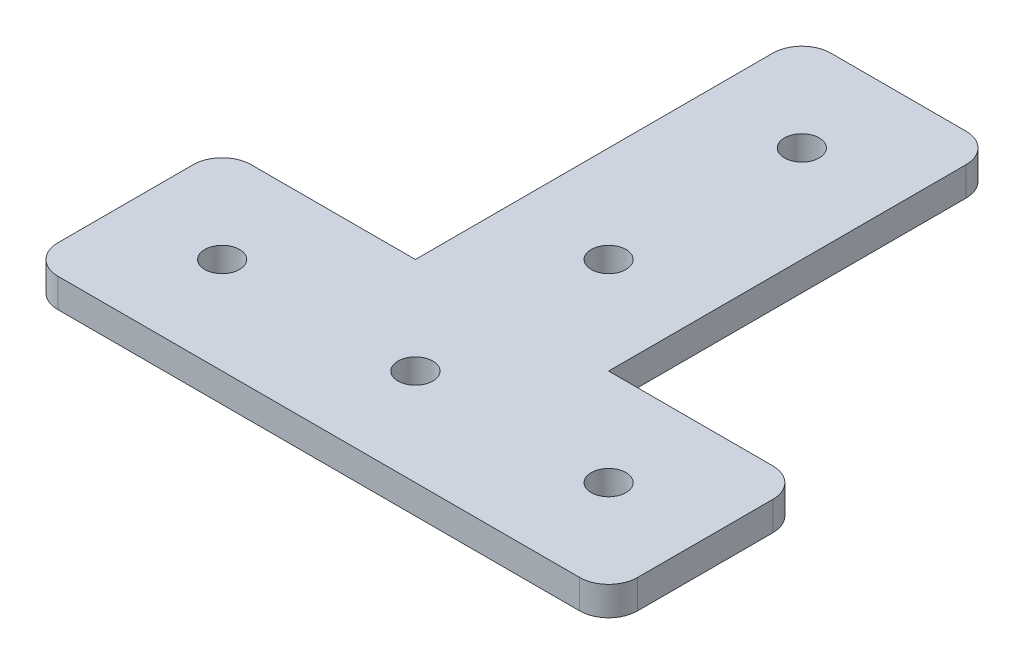
from build123d import *

# Parameters (mm, degrees)
SKETCH_2_W      = 20
SKETCH_2_H      = 40
SKETCH_2_R      = 1.8
SKETCH_2_W_2    = 60
SKETCH_2_H_2    = 20
EXTRUDE_1_DEPTH = 3
FILLET_1_R      = 3


with BuildPart() as part:
    # 草图2 → 凸台-拉伸1 (new body)
    # profile 1 of 2: a face of its own
    with BuildSketch(Plane(origin=(0, 0, 0), x_dir=(1, 0, 0), z_dir=(0, 1, 0))):
        with Locations((0, 30)):
            Rectangle(SKETCH_2_W, SKETCH_2_H)
        with Locations(Location((0, 20, 0), (0, 0, 270))):
            Circle(SKETCH_2_R, mode=Mode.SUBTRACT)
        with Locations(Location((0, 40, 0), (0, 0, 270))):
            Circle(SKETCH_2_R, mode=Mode.SUBTRACT)
    # profile 2 of 2: a face of its own
    with BuildSketch(Plane(origin=(0, 0, 0), x_dir=(1, 0, 0), z_dir=(0, 1, 0))):
        Rectangle(SKETCH_2_W_2, SKETCH_2_H_2)
        with Locations(Location((0, 0, 0), (0, 0, 270))):
            Circle(SKETCH_2_R, mode=Mode.SUBTRACT)
        with Locations(Location((-20, 0, 0), (0, 0, 270))):
            Circle(SKETCH_2_R, mode=Mode.SUBTRACT)
        with Locations(Location((20, 0, 0), (0, 0, 270))):
            Circle(SKETCH_2_R, mode=Mode.SUBTRACT)
    extrude(amount=EXTRUDE_1_DEPTH)

    # 圆角1
    fillet_1_edges = [part.edges().sort_by_distance(p)[0] for p in [
        (30, 1.5, -10),
        (30, 1.5, 10),
        (-30, 1.5, 10),
        (-30, 1.5, -10),
        (-10, 1.5, -50),
        (10, 1.5, -50),
    ]]
    fillet(fillet_1_edges, radius=FILLET_1_R)


solid = part.part
